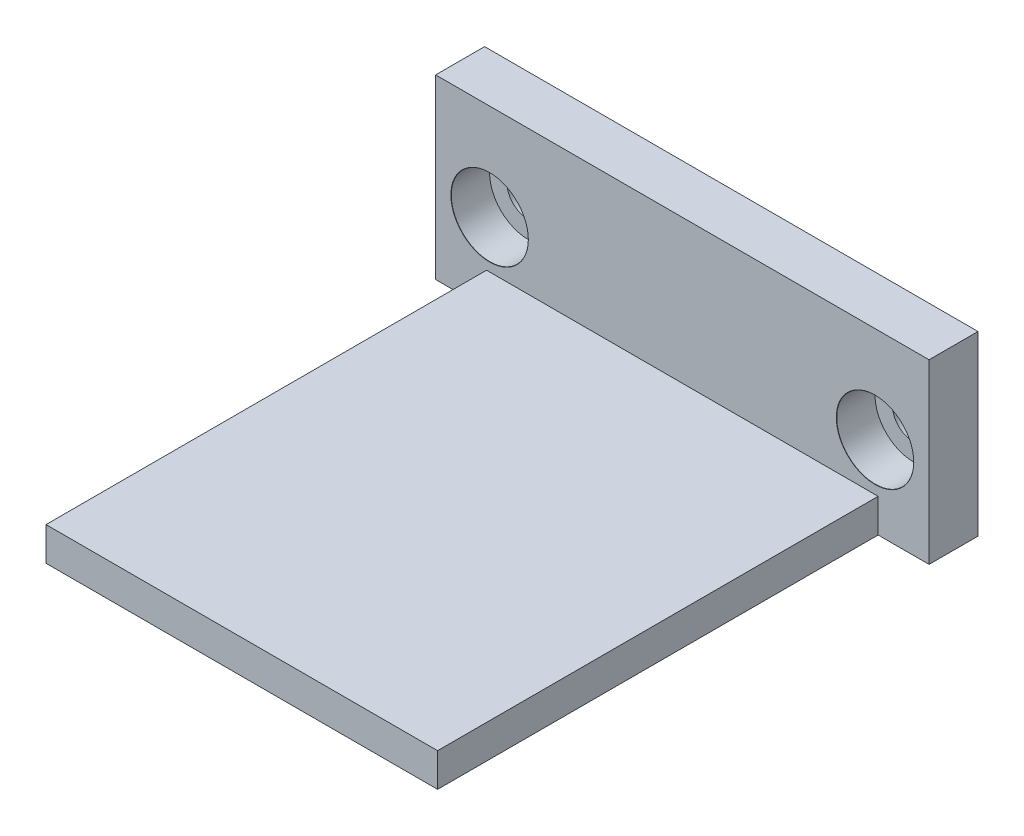
from build123d import *

# Parameters (mm, degrees)
SKETCH1_W                     = 64.008
SKETCH1_H                     = 24.9936
BOSS_EXTRUDE1_DEPTH           = 6.35
SKETCH2_W                     = 64.008
SKETCH2_H                     = 6.35
BOSS_EXTRUDE2_DEPTH           = 57.15
CBORE_FOR_M5_SHCS1_AT_2_COUNT = 2
CBORE_FOR_M5_SHCS1_AT_2_PITCH = 50
SKETCH8_W                     = 6.604
SKETCH8_H                     = 6.35
CUT_EXTRUDE1_DEPTH            = 57.15
CUT_EXTRUDE2_DEPTH            = 90.374641845
CUT_EXTRUDE2_DEPTH_BACK       = 90.374641845
SKETCH9_W                     = 64.008
SKETCH9_H                     = 2.000000064


with BuildPart() as part:
    # Sketch1 → Boss-Extrude1 (new body)
    with BuildSketch(Plane.XY):
        with Locations((32.004, 12.4968)):
            Rectangle(SKETCH1_W, SKETCH1_H)
    extrude(amount=BOSS_EXTRUDE1_DEPTH)

    # Sketch2 → Boss-Extrude2 (add)
    with BuildSketch(Plane.XY.offset(6.35)):
        with Locations((32.004, 3.175)):
            Rectangle(SKETCH2_W, SKETCH2_H)
    extrude(amount=BOSS_EXTRUDE2_DEPTH)

    # Sketch7 → CBORE for M5 SHCS1 (revolve, cut)
    with BuildSketch(Plane(origin=(7, 12.5, 6.35), x_dir=(0, -1, 0), z_dir=(1, 0, 0))):
        Polygon((0, 0), (0, 6.35), (2.75, 6.35), (2.75, 5), (5, 5), (5, 0.025), (5.025, 0), align=None)
    cbore_for_m5_shcs1 = revolve(axis=Axis((7, 12.5, 12.7), (0, 0, -1)), mode=Mode.SUBTRACT)

    # CBORE for M5 SHCS1 at 2: CBORE for M5 SHCS1 ×2
    with Locations(*[(i * CBORE_FOR_M5_SHCS1_AT_2_PITCH, 0, 0) for i in range(1, CBORE_FOR_M5_SHCS1_AT_2_COUNT)]):
        add(cbore_for_m5_shcs1, mode=Mode.SUBTRACT)

    # Sketch8 → Cut-Extrude1 (cut)
    with BuildSketch(Plane.XY.offset(63.5)):
        with Locations((3.302, 3.175)):
            Rectangle(SKETCH8_W, SKETCH8_H)
        with Locations((60.706, 3.175)):
            Rectangle(SKETCH8_W, SKETCH8_H)
    extrude(amount=-CUT_EXTRUDE1_DEPTH, mode=Mode.SUBTRACT)

    # Sketch9 → Cut-Extrude2 (cut, two sides: drawn at the far end of the back side and taken through both)
    with BuildSketch(Plane.XY.offset(6.35).offset(-CUT_EXTRUDE2_DEPTH_BACK)):
        with Locations((32.004, 1.000000032)):
            Rectangle(SKETCH9_W, SKETCH9_H)
    extrude(amount=CUT_EXTRUDE2_DEPTH + CUT_EXTRUDE2_DEPTH_BACK, mode=Mode.SUBTRACT)


solid = part.part
